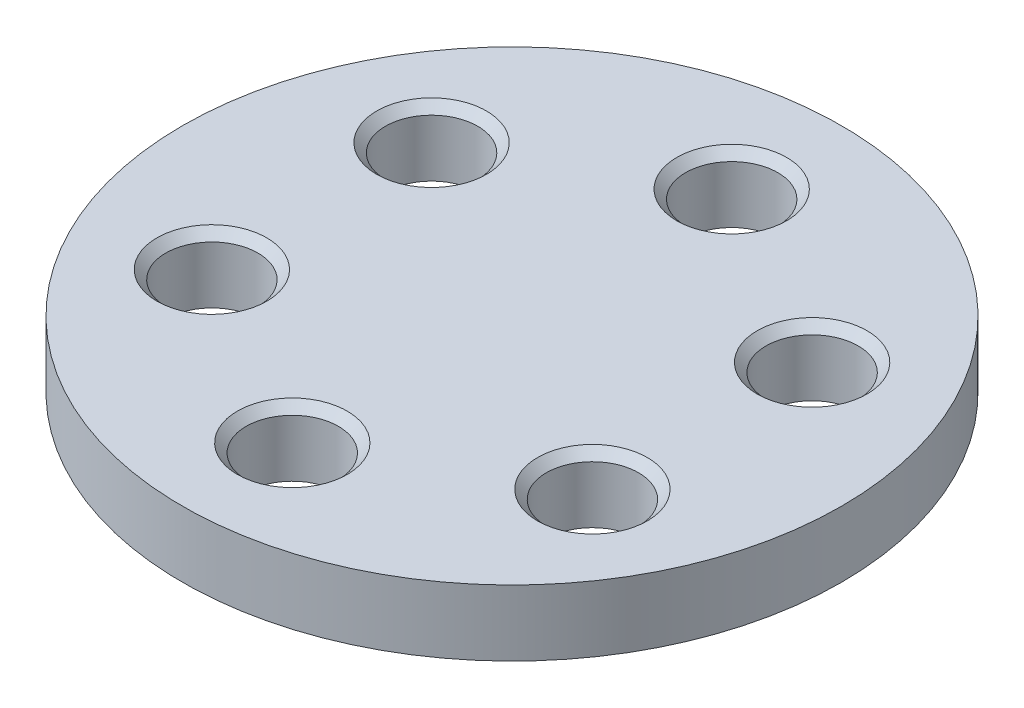
from build123d import *

# Parameters (mm, degrees)
SKETCH_1_R                  = 15
EXTRUDE_1_DEPTH             = 3
HOLE_WIZARD_M41_D           = 4.2
HOLE_WIZARD_M41_CSINK_D     = 5
HOLE_WIZARD_M41_CSINK_ANGLE = 90


with BuildPart() as part:
    # Эскиз1 → Бобышка-Вытянуть1 (new body)
    with BuildSketch(Plane.XZ.offset(-41)):
        Circle(SKETCH_1_R)
    extrude(amount=-EXTRUDE_1_DEPTH)

    # Сверло под метчик  спиральное M41 (through all)
    with Locations(Plane(origin=(0, 44, 0), x_dir=(1, 0, 0), z_dir=(0, 1, 0))):
        with Locations((-8.660254038, 5), (0, 10), (8.660254038, 5), (8.660254038, -5), (0, -10), (-8.660254038, -5)):
            CounterSinkHole(HOLE_WIZARD_M41_D / 2, HOLE_WIZARD_M41_CSINK_D / 2, counter_sink_angle=HOLE_WIZARD_M41_CSINK_ANGLE)


solid = part.part
